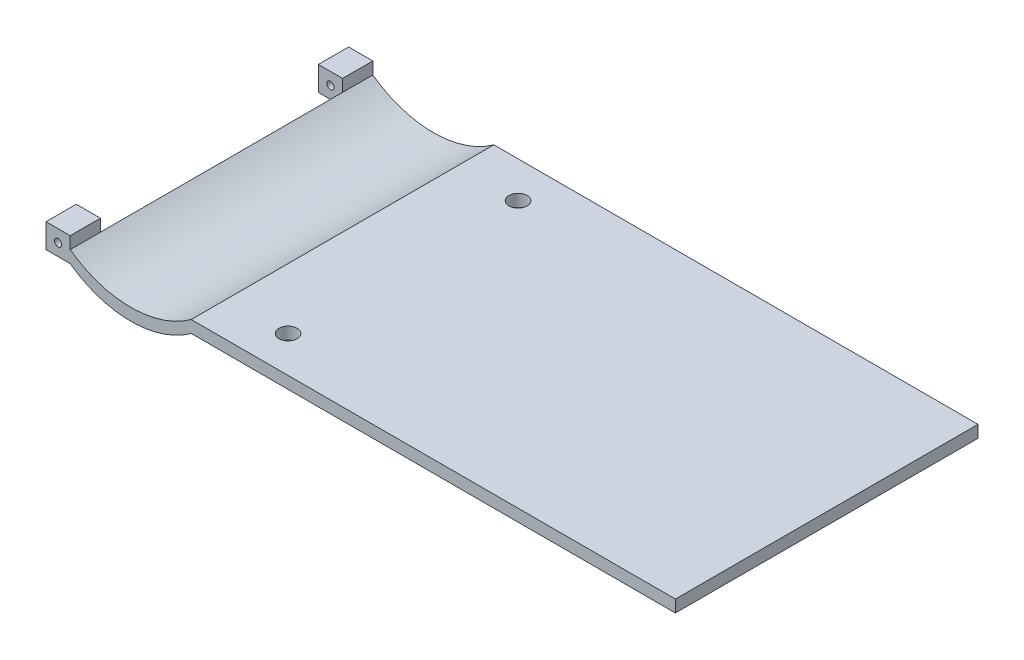
from build123d import *

# Parameters (mm, degrees)
SKETCH_1_W          = 800
SKETCH_1_H          = 20
SKETCH_1_R          = 6
EXTRUDE_1_DEPTH     = 500
SKETCH_5_R          = 15
CUT_EXTRUDE_2_DEPTH = 814.854186619
SKETCH_6_W          = 40
SKETCH_6_H          = 400
CUT_EXTRUDE_3_DEPTH = 816.389199244


with BuildPart() as part:
    # 草图1 → 凸台-拉伸1 (new body)
    # profile 1 of 3: a face of its own
    with BuildSketch(Plane.XY):
        Rectangle(SKETCH_1_W, SKETCH_1_H)
    # profile 2 of 3: a face of its own
    with BuildSketch(Plane.XY):
        with BuildLine():
            ThreePointArc((-600, -10), (-500, -42.522729151), (-400, -10))
            Line((-400, -10), (-400, 10))
            ThreePointArc((-400, 10), (-500, -22.522729151), (-600, 10))
            Line((-600, 10), (-600, -10))
        make_face()
    # profile 3 of 3: a face of its own
    with BuildSketch(Plane.XY):
        Polygon((-640, -10), (-600, -10), (-600, 10), (-600, 30), (-640, 30), align=None)
        with Locations((-620, 10)):
            Circle(SKETCH_1_R, mode=Mode.SUBTRACT)
    extrude(amount=EXTRUDE_1_DEPTH)

    # 草图5 → 切除-拉伸2 (cut, through all)
    with BuildSketch(Plane(origin=(0, 10, 0), x_dir=(1, 0, 0), z_dir=(0, 1, 0))):
        with Locations(Location((-300, -440, 0), (0, 0, 180))):
            Circle(SKETCH_5_R)
        with Locations(Location((-300, -60, 0), (0, 0, 180))):
            Circle(SKETCH_5_R)
    extrude(amount=-CUT_EXTRUDE_2_DEPTH, mode=Mode.SUBTRACT)

    # 草图6 → 切除-拉伸3 (cut, through all)
    with BuildSketch(Plane(origin=(0, 30, 0), x_dir=(1, 0, 0), z_dir=(0, 1, 0))):
        with Locations((-620, -250)):
            Rectangle(SKETCH_6_W, SKETCH_6_H)
    extrude(amount=-CUT_EXTRUDE_3_DEPTH, mode=Mode.SUBTRACT)


solid = part.part
